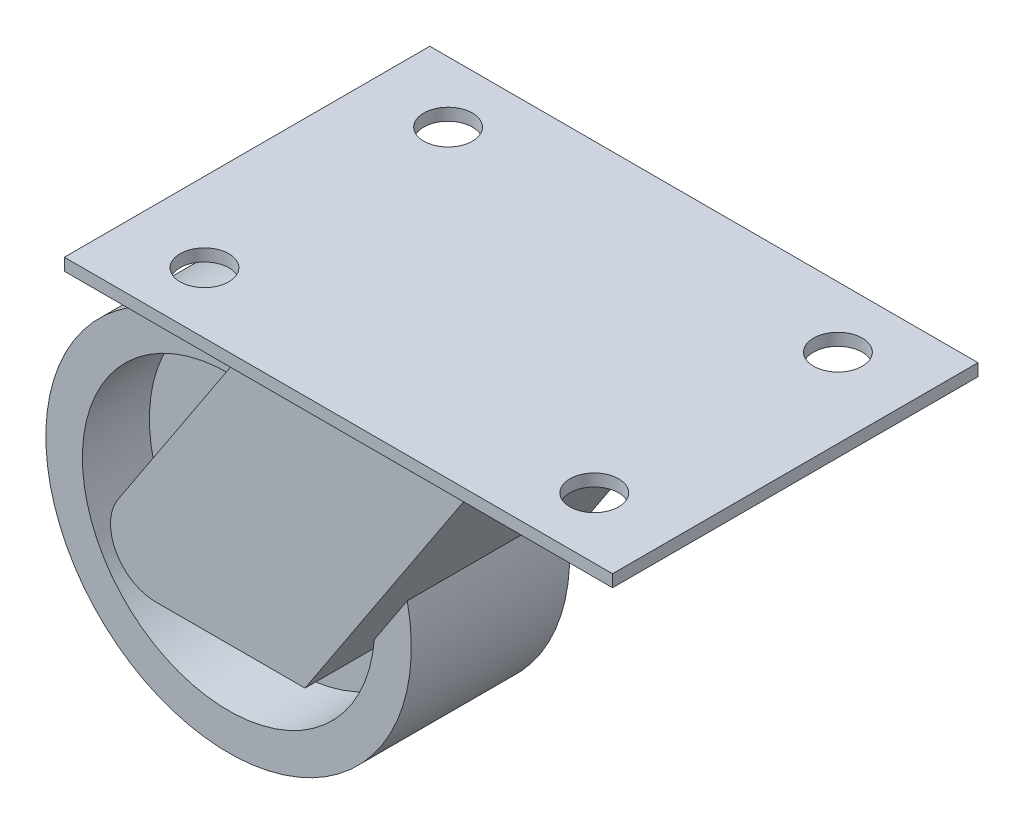
from build123d import *

# Parameters (mm, degrees)
CROQUIS1_R              = 15
CROQUIS1_R_2            = 12
EXTRUIR_L_MINA1_DEPTH   = 6.5
CROQUIS2_R              = 5
SALIENTE_EXTRUIR1_DEPTH = 6.5
CROQUIS3_R              = 12.5
SALIENTE_EXTRUIR2_DEPTH = 1
CROQUIS4_R              = 2
SALIENTE_EXTRUIR3_DEPTH = 11
SALIENTE_EXTRUIR4_DEPTH = 22
CROQUIS7_W              = 45
CROQUIS7_H              = 30
CROQUIS7_R              = 2
SALIENTE_EXTRUIR5_DEPTH = 1


with BuildPart() as part:
    # Croquis1 → Extruir-Lámina1 (new, symmetric)
    with BuildSketch(Plane.XY):
        Circle(CROQUIS1_R)
        Circle(CROQUIS1_R_2, mode=Mode.SUBTRACT)
    extrude(amount=EXTRUIR_L_MINA1_DEPTH, both=True)



with BuildPart() as body_2:
    # Croquis2 → Saliente-Extruir1 (new, symmetric)
    with BuildSketch(Plane.XY):
        with Locations(Location((0, 0, 0), (0, 0, 180))):
            Circle(CROQUIS2_R)
    extrude(amount=SALIENTE_EXTRUIR1_DEPTH, both=True)


with BuildPart() as part_1:
    add(part.part)

    add(body_2.part)  # Saliente-Extruir2 merges body 2
    # Croquis3 → Saliente-Extruir2 (add, symmetric)
    with BuildSketch(Plane.XY):
        Circle(CROQUIS3_R)
    extrude(amount=SALIENTE_EXTRUIR2_DEPTH, both=True)

    # Croquis4 → Saliente-Extruir3 (add, symmetric)
    with BuildSketch(Plane.XY):
        Circle(CROQUIS4_R)
    extrude(amount=SALIENTE_EXTRUIR3_DEPTH, both=True)

    # Croquis6 → Saliente-Extruir4 (add, through all)
    with BuildSketch(Plane.XY.offset(11)):
        with BuildLine():
            Line((-4.581858608, 2.977952867), (7.949667258, 22))
            Line((7.949667258, 22), (27.086339579, 22))
            Line((27.086339579, 22), (10.776903307, -2.756671198))
            Line((10.776903307, -2.756671198), (-1.492562871, -2.756671198))
            ThreePointArc((-1.492562871, -2.756671198), (-4.749465591, -0.811766904), (-4.581858608, 2.977952867))
        make_face()
    extrude(amount=-SALIENTE_EXTRUIR4_DEPTH)

    # Croquis7 → Saliente-Extruir5 (add)
    with BuildSketch(Plane(origin=(0, 22, 0), x_dir=(1, 0, 0), z_dir=(0, 1, 0))):
        with Locations((17.519667258, 0)):
            Rectangle(CROQUIS7_W, CROQUIS7_H)
        with Locations(Location((33.519667258, 10, 0), (0, 0, 270))):
            Circle(CROQUIS7_R, mode=Mode.SUBTRACT)
        with Locations(Location((1.519667258, 10, 0), (0, 0, 90))):
            Circle(CROQUIS7_R, mode=Mode.SUBTRACT)
        with Locations(Location((33.519667258, -10, 0), (0, 0, 90))):
            Circle(CROQUIS7_R, mode=Mode.SUBTRACT)
        with Locations(Location((1.519667258, -10, 0), (0, 0, 270))):
            Circle(CROQUIS7_R, mode=Mode.SUBTRACT)
    extrude(amount=-SALIENTE_EXTRUIR5_DEPTH)


solid = part_1.part
